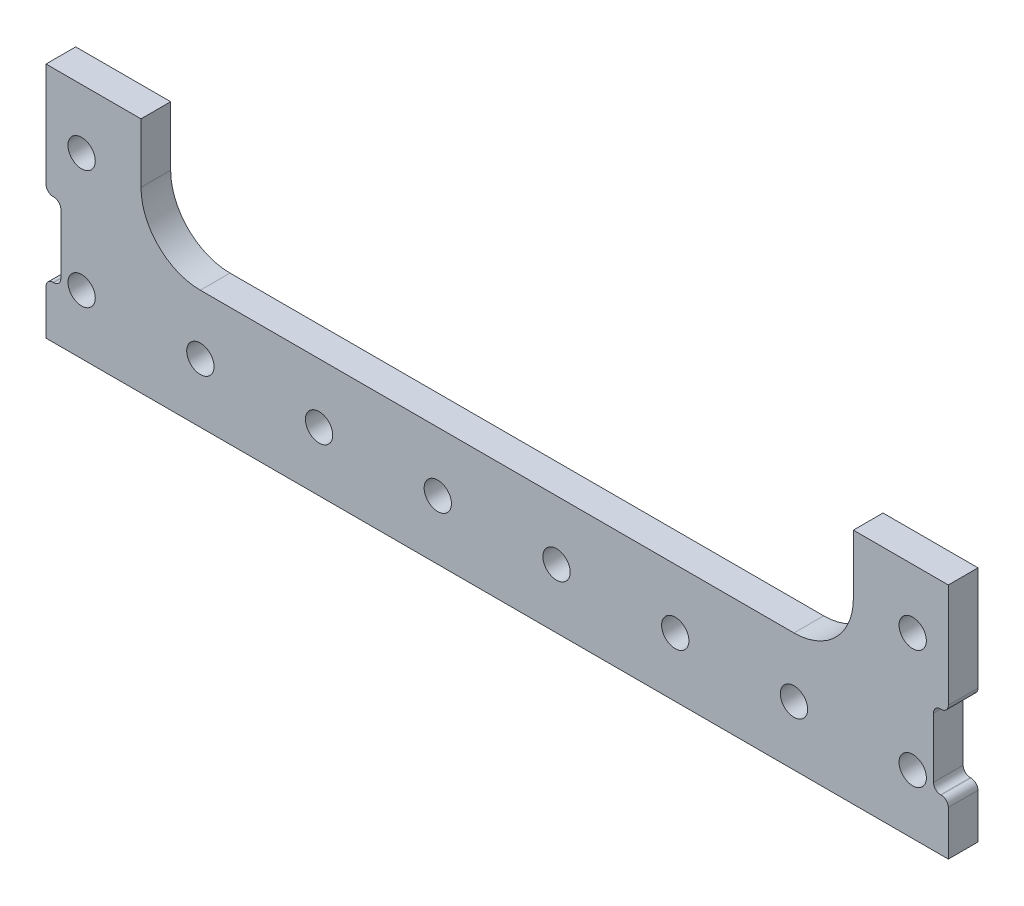
from build123d import *

# Parameters (mm, degrees)
BOSS_EXTRUDE1_DEPTH = 6.35
SKETCH2_R           = 2.921
CUT_EXTRUDE1_DEPTH  = 210.55
SKETCH3_W           = 5.08
SKETCH3_H           = 50.8
CUT_EXTRUDE2_DEPTH  = 210.55
FILLET1_R           = 12.7
SKETCH4_W           = 3.175
SKETCH4_H           = 15.875
CUT_EXTRUDE3_DEPTH  = 205.627703159
FILLET2_R           = 1.524


with BuildPart() as part:
    # Sketch1 → Boss-Extrude1 (new body)
    with BuildSketch(Plane.XY):
        Polygon((0, 0), (0, 50.8), (25.4, 50.8), (25.4, 25.4), (177.8, 25.4), (177.8, 50.8), (203.2, 50.8), (203.2, 0), align=None)
    extrude(amount=BOSS_EXTRUDE1_DEPTH)

    # Sketch2 → Cut-Extrude1 (cut, through all)
    with BuildSketch(Plane.XY.offset(6.35)):
        with Locations((12.7, 38.1)):
            Circle(SKETCH2_R)
        with Locations((12.7, 12.7)):
            Circle(SKETCH2_R)
        with Locations((38.1, 12.7)):
            Circle(SKETCH2_R)
        with Locations((63.5, 12.7)):
            Circle(SKETCH2_R)
        with Locations((88.9, 12.7)):
            Circle(SKETCH2_R)
        with Locations((114.3, 12.7)):
            Circle(SKETCH2_R)
        with Locations((139.7, 12.7)):
            Circle(SKETCH2_R)
        with Locations((165.1, 12.7)):
            Circle(SKETCH2_R)
        with Locations((190.5, 12.7)):
            Circle(SKETCH2_R)
        with Locations(Location((190.5, 38.1, 0), (0, 0, 180))):
            Circle(SKETCH2_R)
    extrude(amount=-CUT_EXTRUDE1_DEPTH, mode=Mode.SUBTRACT)

    # Sketch3 → Cut-Extrude2 (cut, through all)
    with BuildSketch(Plane.XY.offset(6.35)):
        with Locations((2.54, 25.4)):
            Rectangle(SKETCH3_W, SKETCH3_H)
        with Locations((200.66, 25.4)):
            Rectangle(SKETCH3_W, SKETCH3_H)
    extrude(amount=-CUT_EXTRUDE2_DEPTH, mode=Mode.SUBTRACT)

    # Fillet1
    fillet1_edges = [part.edges().sort_by_distance(p)[0] for p in [
        (25.4, 25.4, 3.175),
        (177.8, 25.4, 3.175),
    ]]
    fillet(fillet1_edges, radius=FILLET1_R)

    # Sketch4 → Cut-Extrude3 (cut, through all)
    with BuildSketch(Plane.XY.offset(6.35)):
        with Locations((6.6675, 19.05)):
            Rectangle(SKETCH4_W, SKETCH4_H)
        with Locations((196.5325, 19.05)):
            Rectangle(SKETCH4_W, SKETCH4_H)
    extrude(amount=-CUT_EXTRUDE3_DEPTH, mode=Mode.SUBTRACT)

    # Fillet2
    fillet2_edges = [part.edges().sort_by_distance(p)[0] for p in [
        (5.08, 11.1125, 3.175),
        (5.08, 26.9875, 3.175),
        (8.255, 26.9875, 3.175),
        (8.255, 11.1125, 3.175),
        (198.12, 11.1125, 3.175),
        (194.945, 11.1125, 3.175),
        (194.945, 26.9875, 3.175),
        (198.12, 26.9875, 3.175),
    ]]
    fillet(fillet2_edges, radius=FILLET2_R)


solid = part.part
